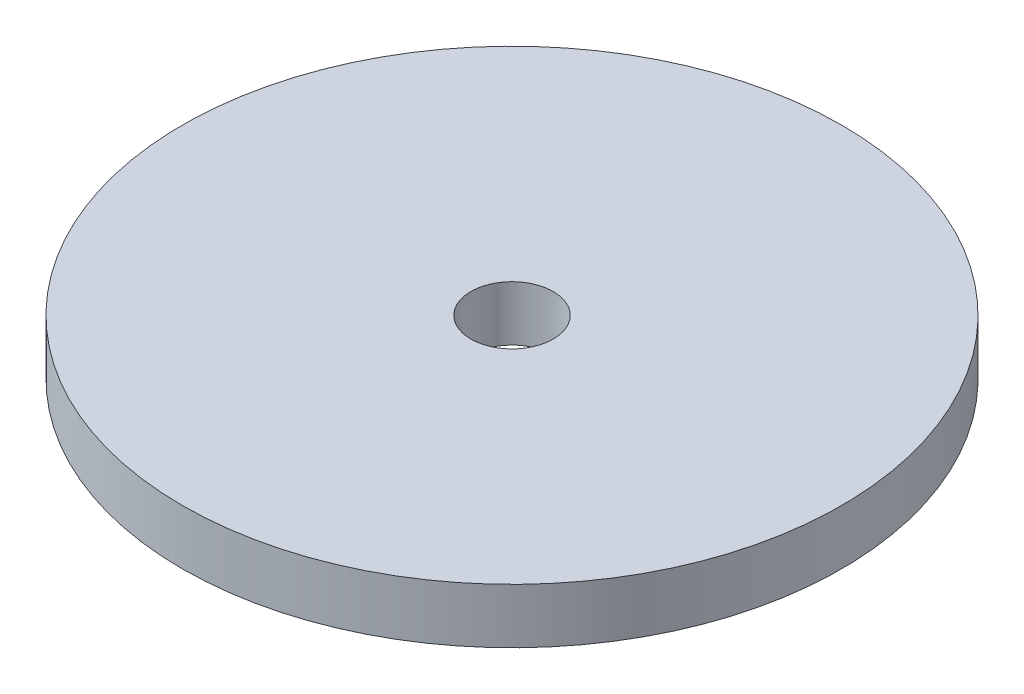
from build123d import *

# Parameters (mm, degrees)
SKETCH1_R           = 19.05
SKETCH1_R_2         = 2.38125
BOSS_EXTRUDE1_DEPTH = 3.175


with BuildPart() as part:
    # Sketch1 → Boss-Extrude1 (new body)
    with BuildSketch(Plane(origin=(0, 0, 0), x_dir=(1, 0, 0), z_dir=(0, 1, 0))):
        with Locations(Location((0, 0, 0), (0, 0, 270))):
            Circle(SKETCH1_R)
        with Locations(Location((0, 0, 0), (0, 0, 270))):
            Circle(SKETCH1_R_2, mode=Mode.SUBTRACT)
    extrude(amount=BOSS_EXTRUDE1_DEPTH)


solid = part.part
